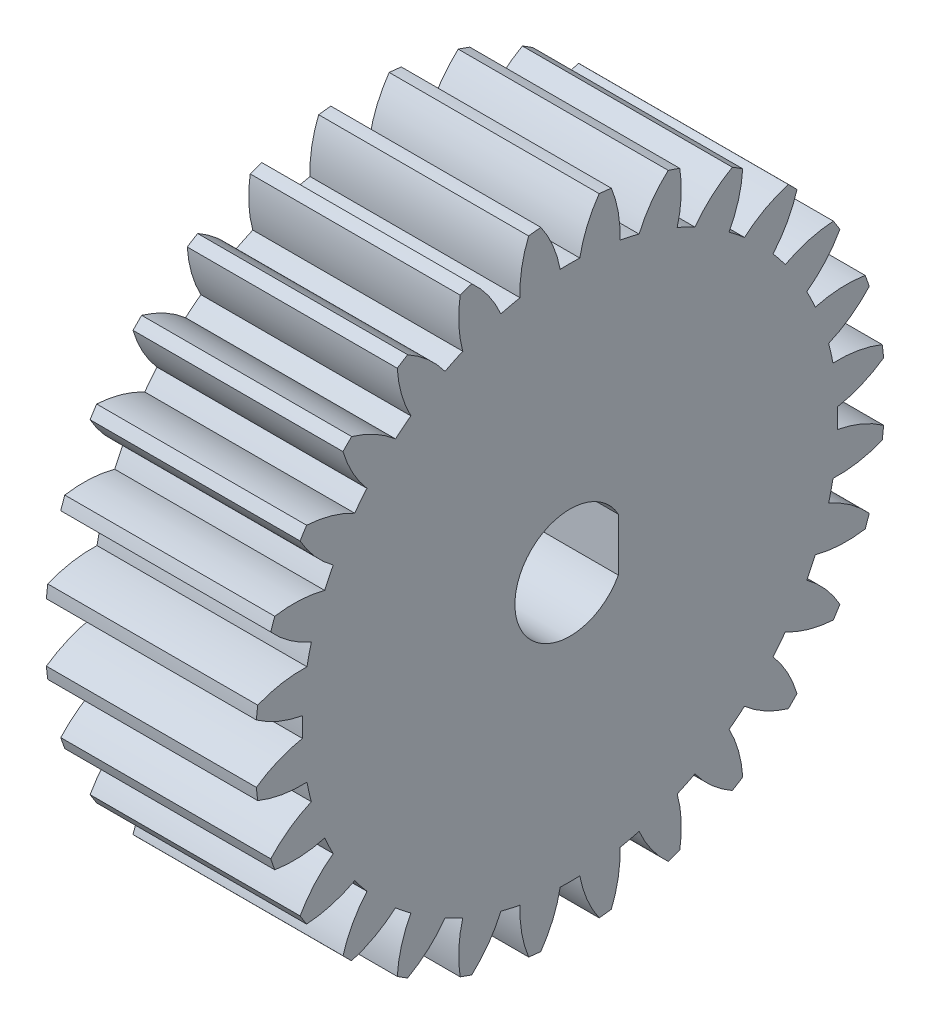
from build123d import *

# Parameters (mm, degrees)
BASPROSKE_W         = 12.5
BASPROSKE_H         = 18.75
TOOTHCUT_DEPTH      = 30.315098499
TEETHCUTS_COUNT     = 28
TEETHCUTS_ANGLE     = 347.142857143
BORSKE_R            = 1
BORE_DEPTH          = 50.0000508
CUT_EXTRUDE1_DEPTH  = 30.212056464
SKETCH2_R           = 3.28
BOSS_EXTRUDE1_DEPTH = 1.5


with BuildPart() as part:
    # BasProSke → Base-Revolve (revolve)
    with BuildSketch(Plane(origin=(0, 0, 0), x_dir=(1, 0, 0), z_dir=(0, 1, 0)), mode=Mode.PRIVATE) as base_revolve_sk:
        with Locations((6.25, 9.375)):
            Rectangle(BASPROSKE_W, BASPROSKE_H)
    revolve(base_revolve_sk.sketch.rotate(Axis((-10, 0, 0), (1, 0, 0)), 180), axis=Axis((-10, 0, 0), (1, 0, 0)))

    # TooCutSke → ToothCut (cut, through all)
    with BuildSketch(Plane(origin=(0, 0, 0), x_dir=(0, 0, -1), z_dir=(1, 0, 0))):
        with BuildLine():
            ThreePointArc((0.585229427, 15.925750807), (0, 15.9365), (-0.585229427, 15.925750807))
            ThreePointArc((-0.585229427, 15.925750807), (-1.019072842, 17.372951322), (-1.753340618, 18.693352878))
            ThreePointArc((-1.753340618, 18.693352878), (0, 18.7754), (1.753340618, 18.693352878))
            ThreePointArc((1.753340618, 18.693352878), (1.019072842, 17.372951322), (0.585229427, 15.925750807))
        make_face()
    toothcut = extrude(amount=TOOTHCUT_DEPTH, mode=Mode.SUBTRACT)

    # TeethCuts: ToothCut ×28 about axis
    teethcuts_axis = Axis((-10, 0, 0), (1, 0, 0))
    for i in range(1, TEETHCUTS_COUNT):
        add(toothcut.rotate(teethcuts_axis, i * TEETHCUTS_ANGLE / (TEETHCUTS_COUNT - 1)), mode=Mode.SUBTRACT)

    # BorSke → Bore (cut, symmetric)
    with BuildSketch(Plane(origin=(0, 0, 0), x_dir=(0, 0, -1), z_dir=(1, 0, 0))):
        with Locations(Location((0, 0, 0), (0, 0, 180))):
            Circle(BORSKE_R)
    extrude(amount=BORE_DEPTH, both=True, mode=Mode.SUBTRACT)

    # Sketch1 → Cut-Extrude1 (cut, through all)
    with BuildSketch(Plane.ZY):
        with BuildLine():
            Line((-2.88, 1.56971335), (-2.88, -1.56971335))
            ThreePointArc((-2.88, -1.56971335), (3.28, 0), (-2.88, 1.56971335))
        make_face()
    extrude(amount=-CUT_EXTRUDE1_DEPTH, mode=Mode.SUBTRACT)

    # Sketch2 → Boss-Extrude1 (add)
    with BuildSketch(Plane.ZY):
        Circle(SKETCH2_R)
    extrude(amount=-BOSS_EXTRUDE1_DEPTH)


solid = part.part
